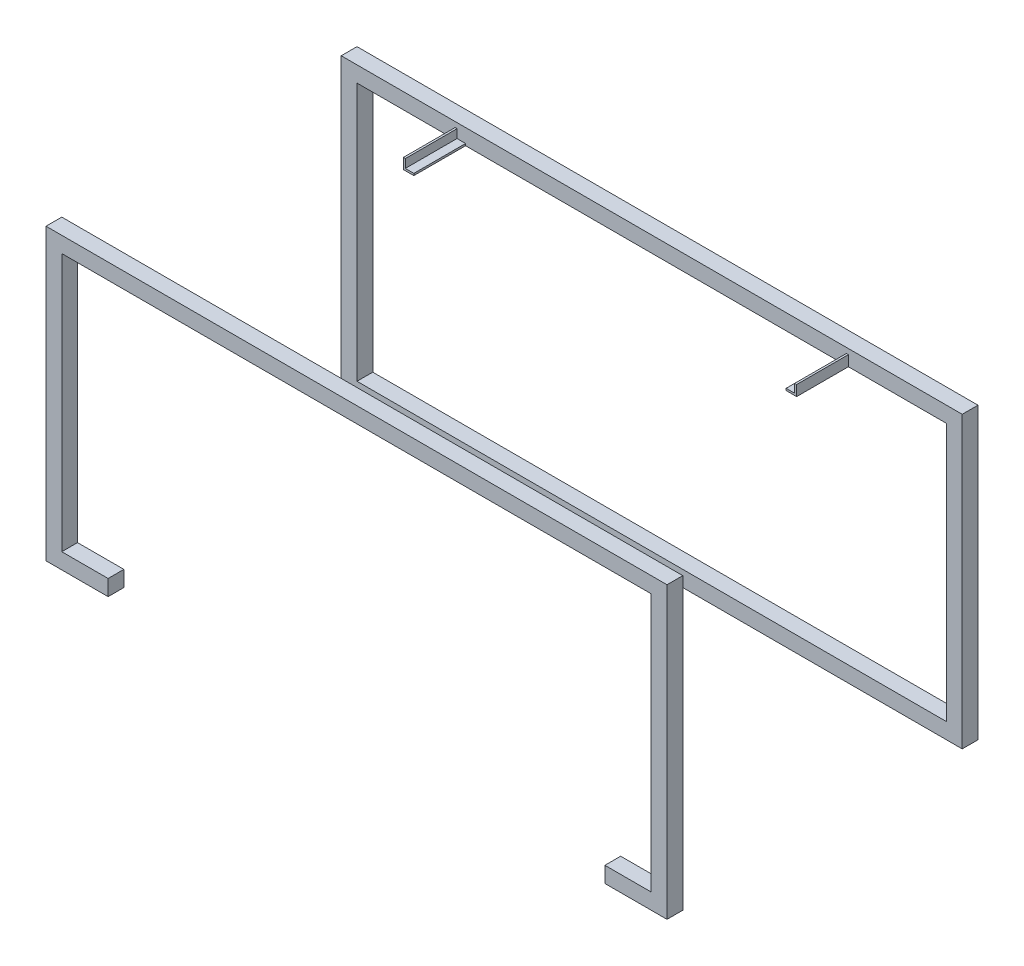
from build123d import *

# Parameters (mm, degrees)
CROQUIS1_W              = 3000
CROQUIS1_H              = 1400
CROQUIS1_W_2            = 2847.6
CROQUIS1_H_2            = 1247.6
SALIENTE_EXTRUIR1_DEPTH = 76.2
CROQUIS2_W              = 76.2
CROQUIS2_H              = 76.2
SALIENTE_EXTRUIR2_DEPTH = 1350
CROQUIS3_W              = 3000
CROQUIS3_H              = 1400
CROQUIS3_W_2            = 2847.6
CROQUIS3_H_2            = 1247.6
SALIENTE_EXTRUIR3_DEPTH = 76.2
CROQUIS10_W             = 320
CROQUIS10_H             = 76.2
CORTAR_EXTRUIR2_DEPTH   = 76.2
CROQUIS11_W             = 76.2
CROQUIS11_H             = 1350
CORTAR_EXTRUIR3_DEPTH   = 76.2
CROQUIS13_W             = 2300
CROQUIS13_H             = 76.2
CORTAR_EXTRUIR5_DEPTH   = 80
SALIENTE_EXTRUIR4_DEPTH = 250
CROQUIS15_W             = 1350
CROQUIS15_H             = 76.2
CORTAR_EXTRUIR6_DEPTH   = 3000


with BuildPart() as part:
    # Croquis1 → Saliente-Extruir1 (new body)
    with BuildSketch(Plane.XY):
        with Locations((1500, 700)):
            Rectangle(CROQUIS1_W, CROQUIS1_H)
        with Locations((1500, 700)):
            Rectangle(CROQUIS1_W_2, CROQUIS1_H_2, mode=Mode.SUBTRACT)
    extrude(amount=SALIENTE_EXTRUIR1_DEPTH)

    # Croquis2 → Saliente-Extruir2 (add)
    with BuildSketch(Plane.XY.offset(76.2)):
        with Locations((38.1, 1361.9)):
            Rectangle(CROQUIS2_W, CROQUIS2_H)
        with Locations((2961.9, 1361.9)):
            Rectangle(CROQUIS2_W, CROQUIS2_H)
        with Locations((2961.9, 38.1)):
            Rectangle(CROQUIS2_W, CROQUIS2_H)
        with Locations((38.1, 38.1)):
            Rectangle(CROQUIS2_W, CROQUIS2_H)
    extrude(amount=SALIENTE_EXTRUIR2_DEPTH)

    # Croquis3 → Saliente-Extruir3 (add)
    with BuildSketch(Plane.XY.offset(1426.2)):
        with Locations((1500, 700)):
            Rectangle(CROQUIS3_W, CROQUIS3_H)
        with Locations((1500, 700)):
            Rectangle(CROQUIS3_W_2, CROQUIS3_H_2, mode=Mode.SUBTRACT)
    extrude(amount=SALIENTE_EXTRUIR3_DEPTH)

    # Croquis10 → Cortar-Extruir2 (cut)
    with BuildSketch(Plane.XY.offset(1502.4)):
        with Locations((460, 38.1)):
            Rectangle(CROQUIS10_W, CROQUIS10_H)
    extrude(amount=-CORTAR_EXTRUIR2_DEPTH, mode=Mode.SUBTRACT)

    # Croquis11 → Cortar-Extruir3 (cut)
    with BuildSketch(Plane(origin=(0, 1400, 0), x_dir=(1, 0, 0), z_dir=(0, 1, 0))):
        with Locations((2961.9, -751.2)):
            Rectangle(CROQUIS11_W, CROQUIS11_H)
        with Locations((38.1, -751.2)):
            Rectangle(CROQUIS11_W, CROQUIS11_H)
    extrude(amount=-CORTAR_EXTRUIR3_DEPTH, mode=Mode.SUBTRACT)

    # Croquis13 → Cortar-Extruir5 (cut)
    with BuildSketch(Plane.XZ):
        with Locations((1550, 1464.3)):
            Rectangle(CROQUIS13_W, CROQUIS13_H)
    extrude(amount=-CORTAR_EXTRUIR5_DEPTH, mode=Mode.SUBTRACT)

    # Croquis14 → Saliente-Extruir4 (add)
    with BuildSketch(Plane.XY.offset(76.2)):
        Polygon((550, 1323.8), (550, 1374.6), (559.525, 1374.6), (559.525, 1333.325), (600.8, 1333.325), (600.8, 1323.8), align=None)
        Polygon((2399.2, 1333.325), (2399.2, 1323.8), (2450, 1323.8), (2450, 1374.6), (2440.475, 1374.6), (2440.475, 1333.325), align=None)
    extrude(amount=SALIENTE_EXTRUIR4_DEPTH)

    # Croquis15 → Cortar-Extruir6 (cut)
    with BuildSketch(Plane.ZY):
        with Locations((751.2, 38.1)):
            Rectangle(CROQUIS15_W, CROQUIS15_H)
    extrude(amount=-CORTAR_EXTRUIR6_DEPTH, mode=Mode.SUBTRACT)


with BuildPart() as cortar_extruir6_piece_1:
    # of the separate pieces the step leaves, piece 1, a body of its own (cortar_extruir6_pieces)
    add(part.part.solids().sort_by_distance((0, 0, 0))[0])


with BuildPart() as cortar_extruir6_piece_2:
    # of the separate pieces the step leaves, piece 2, a body of its own (cortar_extruir6_pieces)
    add(part.part.solids().sort_by_distance((0, 1400, 1426.2))[0])


solid = Compound([cortar_extruir6_piece_1.part, cortar_extruir6_piece_2.part])
